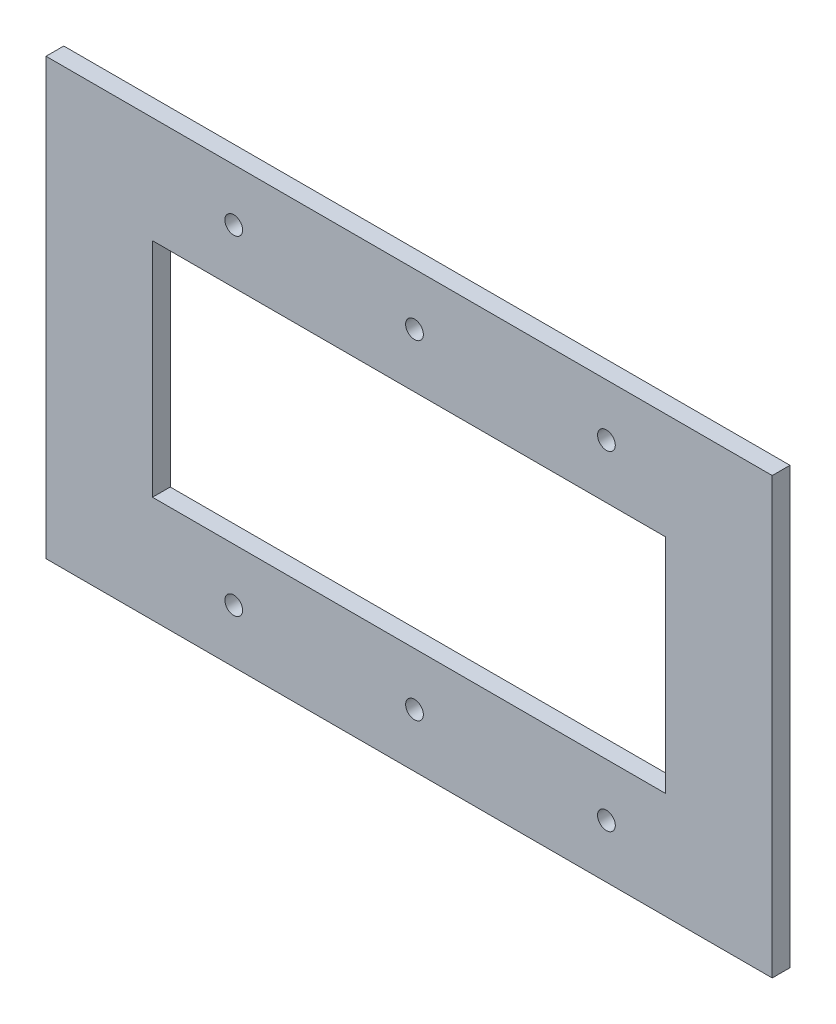
from build123d import *

# Parameters (mm, degrees)
SKETCH1_W                   = 259.842
SKETCH1_H                   = 155.702
SKETCH1_W_2                 = 183.642
SKETCH1_H_2                 = 79.502
BOSS_EXTRUDE1_DEPTH         = 6.35
F_1_4_0_25_DIAMETER_SLOT1_D = 6.35


with BuildPart() as part:
    # Sketch1 → Boss-Extrude1 (new body)
    with BuildSketch(Plane.XY):
        with Locations((91.821, 39.751)):
            Rectangle(SKETCH1_W, SKETCH1_H)
        with Locations((91.821, 39.751)):
            Rectangle(SKETCH1_W_2, SKETCH1_H_2, mode=Mode.SUBTRACT)
    extrude(amount=BOSS_EXTRUDE1_DEPTH)

    # 1/4 (0.25) Diameter Slot1 (through all)
    with Locations(Plane.XY.offset(6.35)):
        with Locations((29.067540373, 98.907455137), (93.740319595, 98.907455137), (162.414380138, 98.907455137), (162.414380138, -18.916352314), (93.740319595, -18.916352314), (29.067540373, -18.916352314)):
            Hole(F_1_4_0_25_DIAMETER_SLOT1_D / 2)


solid = part.part
